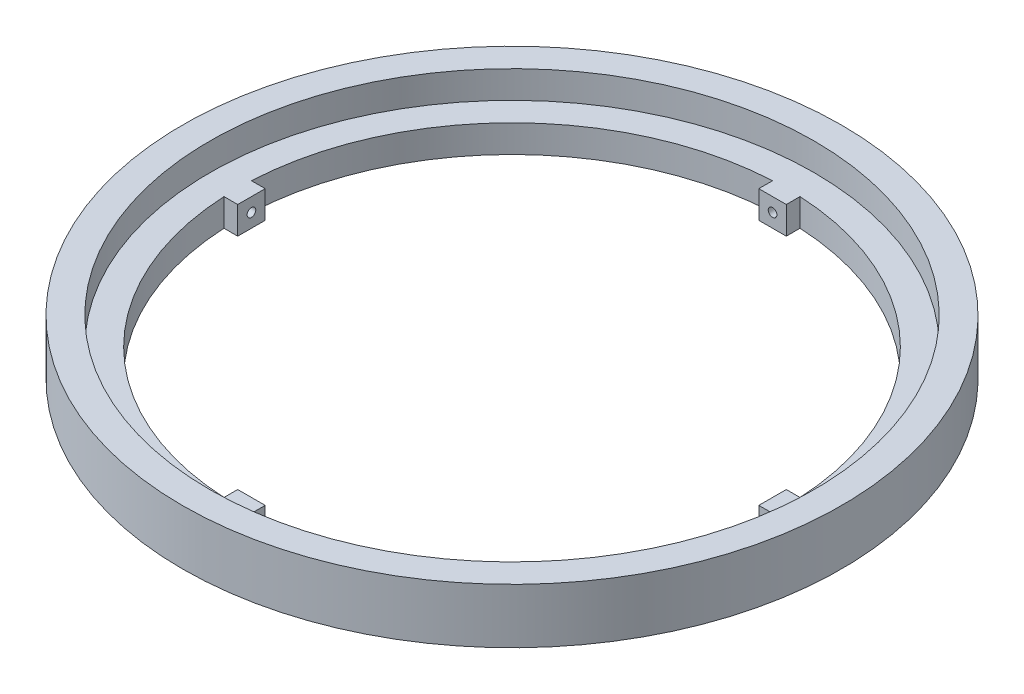
from build123d import *

# Parameters (mm, degrees)
SKETCH1_R           = 152.4
SKETCH1_R_2         = 139.7
BOSS_EXTRUDE1_DEPTH = 25.4
SKETCH1_3_R         = 139.7
SKETCH1_3_R_2       = 127
BOSS_EXTRUDE2_DEPTH = 12.7
BOSS_EXTRUDE3_DEPTH = 12.7
SKETCH3_R           = 2
CUT_EXTRUDE1_DEPTH  = 25.4
CIRPATTERN1_COUNT   = 4


with BuildPart() as part:
    # Sketch1 → Boss-Extrude1 (new body)
    with BuildSketch(Plane(origin=(0, 0, 0), x_dir=(1, 0, 0), z_dir=(0, 1, 0))):
        Circle(SKETCH1_R)
        Circle(SKETCH1_R_2, mode=Mode.SUBTRACT)
    extrude(amount=BOSS_EXTRUDE1_DEPTH)

    # Sketch1<3> → Boss-Extrude2 (add)
    with BuildSketch(Plane(origin=(0, 0, 0), x_dir=(1, 0, 0), z_dir=(0, 1, 0))):
        Circle(SKETCH1_3_R)
        Circle(SKETCH1_3_R_2, mode=Mode.SUBTRACT)
    extrude(amount=BOSS_EXTRUDE2_DEPTH)

    # Sketch2 → Boss-Extrude3 (add)
    with BuildSketch(Plane.XZ):
        with BuildLine():
            ThreePointArc((-6.35, -126.841150657), (0, -127), (6.35, -126.841150657))
            Line((6.35, -126.841150657), (6.35, -120.491150657))
            Line((6.35, -120.491150657), (-6.35, -120.491150657))
            Line((-6.35, -120.491150657), (-6.35, -126.841150657))
        make_face()
        with BuildLine():
            ThreePointArc((-126.841150657, 6.35), (-127, 0), (-126.841150657, -6.35))
            Line((-126.841150657, -6.35), (-120.491150657, -6.35))
            Line((-120.491150657, -6.35), (-120.491150657, 6.35))
            Line((-120.491150657, 6.35), (-126.841150657, 6.35))
        make_face()
        with BuildLine():
            Line((120.491150657, -6.35), (126.841150657, -6.35))
            ThreePointArc((126.841150657, -6.35), (127, 0), (126.841150657, 6.35))
            Line((126.841150657, 6.35), (120.491150657, 6.35))
            Line((120.491150657, 6.35), (120.491150657, -6.35))
        make_face()
        with BuildLine():
            ThreePointArc((6.35, 126.841150657), (0, 127), (-6.35, 126.841150657))
            Line((-6.35, 126.841150657), (-6.35, 120.491150657))
            Line((-6.35, 120.491150657), (6.35, 120.491150657))
            Line((6.35, 120.491150657), (6.35, 126.841150657))
        make_face()
    extrude(amount=-BOSS_EXTRUDE3_DEPTH)

    # Sketch3 → Cut-Extrude1 (cut)
    with BuildSketch(Plane(origin=(-120.491150657, 0, 0), x_dir=(0, 0, -1), z_dir=(1, 0, 0))):
        with Locations((0, 6.35)):
            Circle(SKETCH3_R)
    cut_extrude1 = extrude(amount=-CUT_EXTRUDE1_DEPTH, mode=Mode.SUBTRACT)

    # CirPattern1: Cut-Extrude1 ×4 about axis
    cirpattern1_axis = Axis((0, 12.7, 0), (0, 1, 0))
    for i in range(1, CIRPATTERN1_COUNT):
        add(cut_extrude1.rotate(cirpattern1_axis, i * 360 / CIRPATTERN1_COUNT), mode=Mode.SUBTRACT)


solid = part.part
